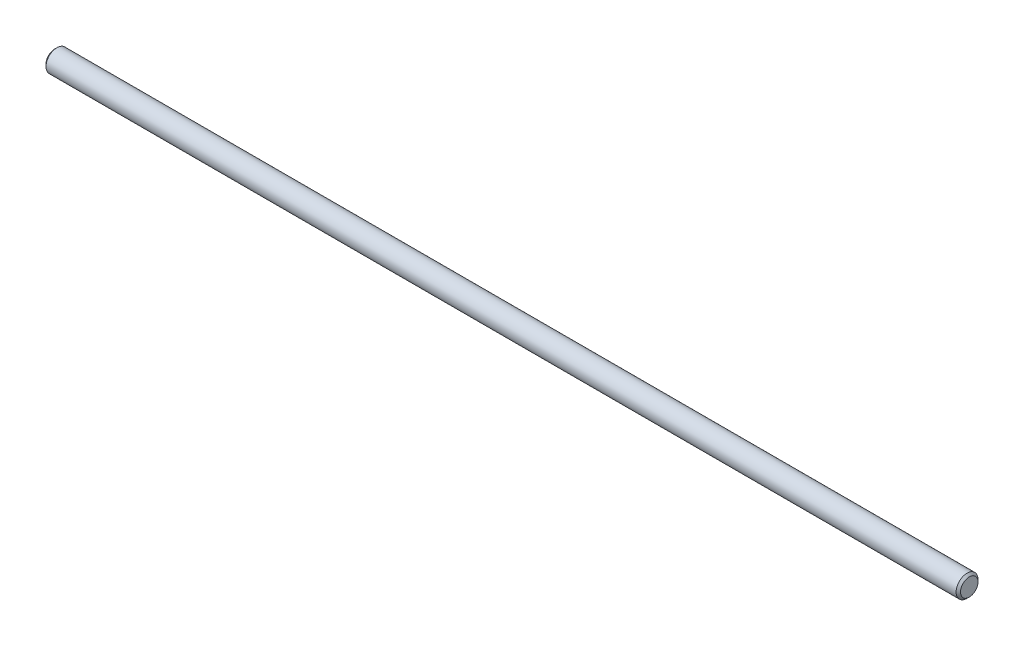
from build123d import *

# Parameters (mm, degrees)
SKETCH1_R           = 5
BOSS_EXTRUDE1_DEPTH = 209
CHAMFER1_SIZE       = 1


with BuildPart() as part:
    # Sketch1 → Boss-Extrude1 (new, symmetric)
    with BuildSketch(Plane(origin=(0, 0, 0), x_dir=(0, 0, -1), z_dir=(1, 0, 0))):
        Circle(SKETCH1_R)
    extrude(amount=BOSS_EXTRUDE1_DEPTH, both=True)

    # Chamfer1
    chamfer1_edges = [part.edges().sort_by_distance(p)[0] for p in [
        (-209, 0, 5),
        (209, 0, 5),
    ]]
    chamfer(chamfer1_edges, length=CHAMFER1_SIZE)


solid = part.part
